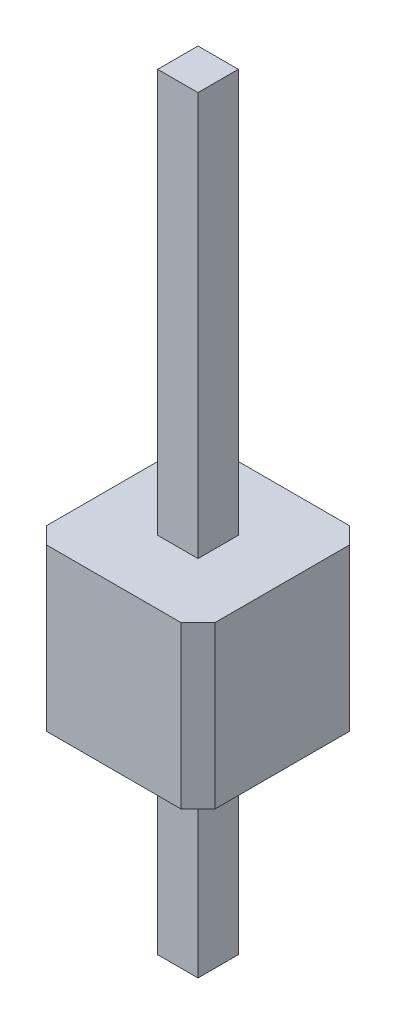
from build123d import *

# Parameters (mm, degrees)
SALIENTE_EXTRUIR1_DEPTH      = 2.4
CROQUIS2_W                   = 0.6
CROQUIS2_H                   = 0.6
SALIENTE_EXTRUIR2_DEPTH      = 6
SALIENTE_EXTRUIR3_DEPTH      = 3
SALIENTE_EXTRUIR3_DEPTH_BACK = 2
CROQUIS3_W                   = 0.6
CROQUIS3_H                   = 0.6


with BuildPart() as part:
    # Croquis1 → Saliente-Extruir1 (new body)
    with BuildSketch(Plane(origin=(0, 0, 0), x_dir=(1, 0, 0), z_dir=(0, 1, 0))):
        Polygon((-1, 1.25), (1, 1.25), (1.25, 1), (1.25, -1), (1, -1.25), (-1, -1.25), (-1.25, -1), (-1.25, 1), align=None)
    extrude(amount=SALIENTE_EXTRUIR1_DEPTH)

    # Croquis2 → Saliente-Extruir2 (add)
    with BuildSketch(Plane(origin=(0, 2.4, 0), x_dir=(1, 0, 0), z_dir=(0, 1, 0))):
        Rectangle(CROQUIS2_W, CROQUIS2_H)
    extrude(amount=SALIENTE_EXTRUIR2_DEPTH)

    # Croquis3 → Saliente-Extruir3 (add, two sides: drawn at the far end of the back side and taken through both)
    with BuildSketch(Plane.XZ.offset(-SALIENTE_EXTRUIR3_DEPTH_BACK)):
        Rectangle(CROQUIS3_W, CROQUIS3_H)
    extrude(amount=SALIENTE_EXTRUIR3_DEPTH + SALIENTE_EXTRUIR3_DEPTH_BACK)


solid = part.part
